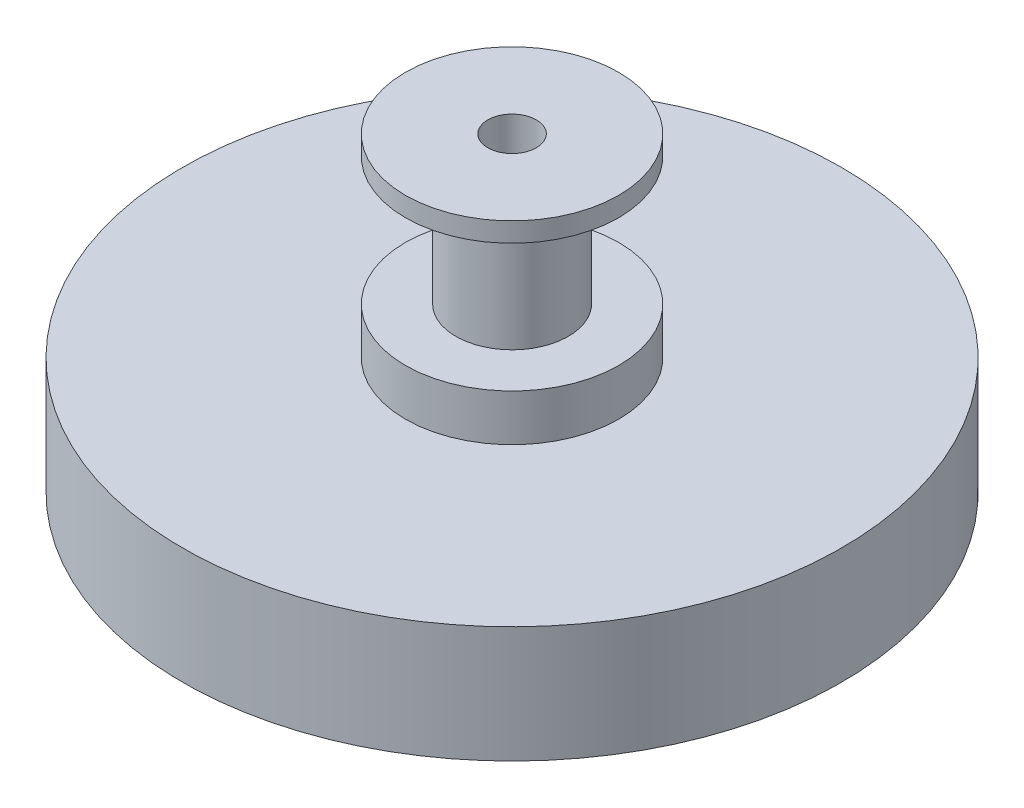
from build123d import *


with BuildPart() as part:
    # Sketch1 → Revolve1 (revolve)
    with BuildSketch(Plane(origin=(0, 0, 0), x_dir=(0, 0, -1), z_dir=(1, 0, 0)), mode=Mode.PRIVATE) as revolve1_sk:
        Polygon((-27.5, 40.712292697), (-85, 40.712292697), (-85, 10.712292697), (-6.25, 10.712292697), (-6.25, 90.712292697), (-27.5, 90.712292697), (-27.5, 85.712292697), (-14.5, 85.712292697), (-14.5, 52.712292697), (-27.5, 52.712292697), align=None)
    revolve(revolve1_sk.sketch.rotate(Axis((0, -5577.839151729, 0), (0, 1, 0)), 180), axis=Axis((0, -5577.839151729, 0), (0, 1, 0)))


solid = part.part
